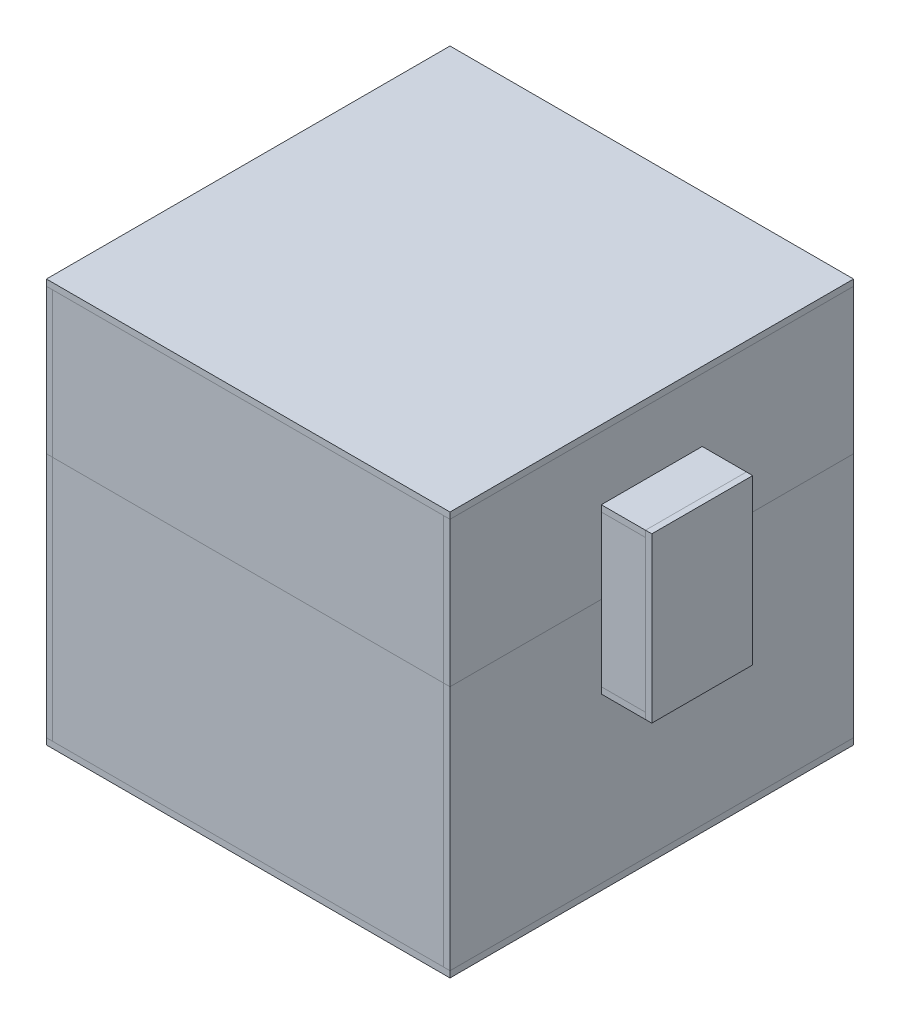
from build123d import *

# Parameters (mm, degrees)
SKETCH1_W            = 203.2
SKETCH1_H            = 203.2
BOSS_EXTRUDE1_DEPTH  = 127
SKETCH2_W            = 190.5
SKETCH2_H            = 190.5
CUT_EXTRUDE1_DEPTH   = 120.65
SKETCH3_W            = 203.2
SKETCH3_H            = 203.2
BOSS_EXTRUDE2_DEPTH  = 76.2
CUT_EXTRUDE2_START   = -6.35
SKETCH5_W            = 190.5
SKETCH5_H            = 190.5
CUT_EXTRUDE2_DEPTH   = 69.85
BOSS_EXTRUDE3_START  = 101.6
SKETCH6_W            = 50.8
SKETCH6_H            = 82.55
BOSS_EXTRUDE3_DEPTH  = 25.4
SKETCH7_R            = 2.499999953
CUT_EXTRUDE3_DEPTH   = 6.35
SKETCH9_W            = 38.1
SKETCH9_H            = 69.85
CUT_EXTRUDE4_DEPTH   = 19.05
BOSS_EXTRUDE4_START  = -3.175
SKETCH10_W           = 44.45
SKETCH10_H           = 76.2
BOSS_EXTRUDE4_DEPTH  = 22.225
SKETCH15_W           = 50.8
SKETCH15_H           = 82.55
BOSS_EXTRUDE5_DEPTH  = 3.175
SKETCH16_W           = 22.225
SKETCH16_H           = 50.8
BOSS_EXTRUDE7_DEPTH  = 3.175
SKETCH18_W           = 22.225
SKETCH18_H           = 50.8
BOSS_EXTRUDE8_DEPTH  = 3.175
SKETCH13_R           = 4.25
CUT_EXTRUDE6_DEPTH   = 3
SKETCH21_W           = 22.225
SKETCH21_H           = 76.2
BOSS_EXTRUDE13_DEPTH = 3.175
SKETCH22_W           = 203.2
SKETCH22_H           = 203.2
BOSS_EXTRUDE14_DEPTH = 3.175
SKETCH23_W           = 203.2
SKETCH23_H           = 73.025
BOSS_EXTRUDE16_DEPTH = 3.175
SKETCH24_W           = 203.2
SKETCH24_H           = 73.025
SKETCH24_R           = 2.499999953
BOSS_EXTRUDE17_DEPTH = 3.175
SKETCH25_W           = 196.85
SKETCH25_H           = 73.025
BOSS_EXTRUDE18_DEPTH = 3.175
SKETCH26_W           = 196.85
SKETCH26_H           = 73.025
BOSS_EXTRUDE19_DEPTH = 3.175
SKETCH27_W           = 203.2
SKETCH27_H           = 203.2
BOSS_EXTRUDE20_DEPTH = 3.175
SKETCH28_W           = 203.2
SKETCH28_H           = 123.825
BOSS_EXTRUDE21_DEPTH = 3.175
SKETCH29_W           = 203.2
SKETCH29_H           = 123.825
SKETCH29_R           = 2.499999953
BOSS_EXTRUDE22_DEPTH = 3.175
SKETCH30_W           = 196.85
SKETCH30_H           = 123.825
BOSS_EXTRUDE23_DEPTH = 3.175
SKETCH31_W           = 196.85
SKETCH31_H           = 123.825
BOSS_EXTRUDE24_DEPTH = 3.175
SKETCH19_W           = 22.225
SKETCH19_H           = 76.2
BOSS_EXTRUDE26_DEPTH = 3.175


with BuildPart() as part:
    # Sketch1 → Boss-Extrude1 (new body)
    with BuildSketch(Plane(origin=(0, 0, 0), x_dir=(1, 0, 0), z_dir=(0, 1, 0))):
        Rectangle(SKETCH1_W, SKETCH1_H)
    extrude(amount=BOSS_EXTRUDE1_DEPTH)

    # Sketch2 → Cut-Extrude1 (cut)
    with BuildSketch(Plane(origin=(0, 127, 0), x_dir=(1, 0, 0), z_dir=(0, 1, 0))):
        Rectangle(SKETCH2_W, SKETCH2_H)
    extrude(amount=-CUT_EXTRUDE1_DEPTH, mode=Mode.SUBTRACT)


with BuildPart() as body_2:
    # Sketch3 → Boss-Extrude2 (new body)
    with BuildSketch(Plane(origin=(0, 127, 0), x_dir=(1, 0, 0), z_dir=(0, 1, 0))):
        Rectangle(SKETCH3_W, SKETCH3_H)
    extrude(amount=BOSS_EXTRUDE2_DEPTH)

    # Sketch5 → Cut-Extrude2 (cut)
    with BuildSketch(Plane(origin=(0, 203.2, 0), x_dir=(1, 0, 0), z_dir=(0, 1, 0)).offset(CUT_EXTRUDE2_START)):
        Rectangle(SKETCH5_W, SKETCH5_H)
    extrude(amount=-CUT_EXTRUDE2_DEPTH, mode=Mode.SUBTRACT)

    # Sketch7 → Cut-Extrude3 (cut)
    with BuildSketch(Plane.ZY.offset(101.6)):
        with Locations((-76.2, 139.999999908)):
            Circle(SKETCH7_R)
        with Locations((-49.699999914, 139.999999908)):
            Circle(SKETCH7_R)
        with Locations((49.699999914, 139.999999908)):
            Circle(SKETCH7_R)
        with Locations((76.2, 139.999999908)):
            Circle(SKETCH7_R)
    cut_extrude3 = extrude(amount=-CUT_EXTRUDE3_DEPTH, mode=Mode.SUBTRACT)


with BuildPart() as body_3:
    # Sketch6 → Boss-Extrude3 (new body)
    with BuildSketch(Plane(origin=(0, 0, 0), x_dir=(0, 0, -1), z_dir=(1, 0, 0)).offset(BOSS_EXTRUDE3_START)):
        with Locations((0, 127)):
            Rectangle(SKETCH6_W, SKETCH6_H)
    extrude(amount=BOSS_EXTRUDE3_DEPTH)

    # Sketch9 → Cut-Extrude4 (cut)
    with BuildSketch(Plane.ZY.offset(-101.6)):
        with Locations((0, 127)):
            Rectangle(SKETCH9_W, SKETCH9_H)
    extrude(amount=-CUT_EXTRUDE4_DEPTH, mode=Mode.SUBTRACT)


with BuildPart() as part_1:
    add(part.part)

    # Mirror4: Cut-Extrude3 across plane
    add(cut_extrude3.mirror(Plane(origin=(0, 127, 0), x_dir=(0, 0, 1), z_dir=(0, -1, 0))), mode=Mode.SUBTRACT)


with BuildPart() as body_4:
    # Sketch10 → Boss-Extrude4 (new body)
    with BuildSketch(Plane.ZY.offset(-120.65).offset(BOSS_EXTRUDE4_START)):
        with Locations((0, 127)):
            Rectangle(SKETCH10_W, SKETCH10_H)
    extrude(amount=BOSS_EXTRUDE4_DEPTH)

    # Sketch13 → Cut-Extrude6 (cut)
    with BuildSketch(Plane.ZY.offset(-101.6)):
        with Locations(Location((0, 107.925, 0), (0, 0, 180))):
            Circle(SKETCH13_R)
    extrude(amount=-CUT_EXTRUDE6_DEPTH, mode=Mode.SUBTRACT)


with BuildPart() as body_5:
    # Sketch15 → Boss-Extrude5 (new body)
    with BuildSketch(Plane(origin=(127, 0, 0), x_dir=(0, 0, -1), z_dir=(1, 0, 0))):
        with Locations((0, 127)):
            Rectangle(SKETCH15_W, SKETCH15_H)
    extrude(amount=-BOSS_EXTRUDE5_DEPTH)


with BuildPart() as body_6:
    # Sketch16 → Boss-Extrude7 (new body)
    with BuildSketch(Plane(origin=(0, 168.275, 0), x_dir=(1, 0, 0), z_dir=(0, 1, 0))):
        with Locations((112.7125, 0)):
            Rectangle(SKETCH16_W, SKETCH16_H)
    extrude(amount=-BOSS_EXTRUDE7_DEPTH)


with BuildPart() as body_7:
    # Sketch18 → Boss-Extrude8 (new body)
    with BuildSketch(Plane.XZ.offset(-85.725)):
        with Locations((112.7125, 0)):
            Rectangle(SKETCH18_W, SKETCH18_H)
    extrude(amount=-BOSS_EXTRUDE8_DEPTH)


with BuildPart() as body_8:
    # Sketch21 → Boss-Extrude13 (new body)
    with BuildSketch(Plane(origin=(0, 0, -25.4), x_dir=(-1, 0, 0), z_dir=(0, 0, -1))):
        with Locations((-112.7125, 127)):
            Rectangle(SKETCH21_W, SKETCH21_H)
    extrude(amount=-BOSS_EXTRUDE13_DEPTH)


with BuildPart() as body_8_2:
    # Sketch22 → Boss-Extrude14 (new body)
    with BuildSketch(Plane(origin=(0, 203.2, 0), x_dir=(1, 0, 0), z_dir=(0, 1, 0))):
        Rectangle(SKETCH22_W, SKETCH22_H)
    extrude(amount=-BOSS_EXTRUDE14_DEPTH)


with BuildPart() as body_9:
    # Sketch23 → Boss-Extrude16 (new body)
    with BuildSketch(Plane(origin=(101.6, 0, 0), x_dir=(0, 0, -1), z_dir=(1, 0, 0))):
        with Locations((0, 163.5125)):
            Rectangle(SKETCH23_W, SKETCH23_H)
    extrude(amount=-BOSS_EXTRUDE16_DEPTH)


with BuildPart() as body_10:
    # Sketch24 → Boss-Extrude17 (new body)
    with BuildSketch(Plane.ZY.offset(101.6)):
        with Locations((0, 163.5125)):
            Rectangle(SKETCH24_W, SKETCH24_H)
        with Locations((76.2, 139.999999908)):
            Circle(SKETCH24_R, mode=Mode.SUBTRACT)
        with Locations((49.699999914, 139.999999908)):
            Circle(SKETCH24_R, mode=Mode.SUBTRACT)
        with Locations((-49.699999914, 139.999999908)):
            Circle(SKETCH24_R, mode=Mode.SUBTRACT)
        with Locations((-76.2, 139.999999908)):
            Circle(SKETCH24_R, mode=Mode.SUBTRACT)
    extrude(amount=-BOSS_EXTRUDE17_DEPTH)


with BuildPart() as body_11:
    # Sketch25 → Boss-Extrude18 (new body)
    with BuildSketch(Plane.XY.offset(101.6)):
        with Locations((0, 163.5125)):
            Rectangle(SKETCH25_W, SKETCH25_H)
    extrude(amount=-BOSS_EXTRUDE18_DEPTH)


with BuildPart() as body_12:
    # Sketch26 → Boss-Extrude19 (new body)
    with BuildSketch(Plane(origin=(0, 0, -101.6), x_dir=(-1, 0, 0), z_dir=(0, 0, -1))):
        with Locations((0, 163.5125)):
            Rectangle(SKETCH26_W, SKETCH26_H)
    extrude(amount=-BOSS_EXTRUDE19_DEPTH)


with BuildPart() as body_12_2:
    # Sketch27 → Boss-Extrude20 (new body)
    with BuildSketch(Plane.XZ):
        Rectangle(SKETCH27_W, SKETCH27_H)
    extrude(amount=-BOSS_EXTRUDE20_DEPTH)


with BuildPart() as body_13:
    # Sketch28 → Boss-Extrude21 (new body)
    with BuildSketch(Plane(origin=(101.6, 0, 0), x_dir=(0, 0, -1), z_dir=(1, 0, 0))):
        with Locations((0, 65.0875)):
            Rectangle(SKETCH28_W, SKETCH28_H)
    extrude(amount=-BOSS_EXTRUDE21_DEPTH)


with BuildPart() as body_14:
    # Sketch29 → Boss-Extrude22 (new body)
    with BuildSketch(Plane.ZY.offset(101.6)):
        with Locations((0, 65.0875)):
            Rectangle(SKETCH29_W, SKETCH29_H)
        with Locations((76.2, 114.000000092)):
            Circle(SKETCH29_R, mode=Mode.SUBTRACT)
        with Locations((49.699999914, 114.000000092)):
            Circle(SKETCH29_R, mode=Mode.SUBTRACT)
        with Locations((-49.699999914, 114.000000092)):
            Circle(SKETCH29_R, mode=Mode.SUBTRACT)
        with Locations((-76.2, 114.000000092)):
            Circle(SKETCH29_R, mode=Mode.SUBTRACT)
    extrude(amount=-BOSS_EXTRUDE22_DEPTH)


with BuildPart() as body_15:
    # Sketch30 → Boss-Extrude23 (new body)
    with BuildSketch(Plane.XY.offset(101.6)):
        with Locations((0, 65.0875)):
            Rectangle(SKETCH30_W, SKETCH30_H)
    extrude(amount=-BOSS_EXTRUDE23_DEPTH)


with BuildPart() as body_16:
    # Sketch31 → Boss-Extrude24 (new body)
    with BuildSketch(Plane(origin=(0, 0, -101.6), x_dir=(-1, 0, 0), z_dir=(0, 0, -1))):
        with Locations((0, 65.0875)):
            Rectangle(SKETCH31_W, SKETCH31_H)
    extrude(amount=-BOSS_EXTRUDE24_DEPTH)


with BuildPart() as body_16_2:
    # Sketch19 → Boss-Extrude26 (new body)
    with BuildSketch(Plane.XY.offset(25.4)):
        with Locations((112.7125, 127)):
            Rectangle(SKETCH19_W, SKETCH19_H)
    extrude(amount=-BOSS_EXTRUDE26_DEPTH)


solid = Compound([body_4.part, body_5.part, body_6.part, body_7.part, body_8.part, body_8_2.part, body_9.part, body_10.part, body_11.part, body_12.part, body_12_2.part, body_13.part, body_14.part, body_15.part, body_16.part, body_16_2.part])
